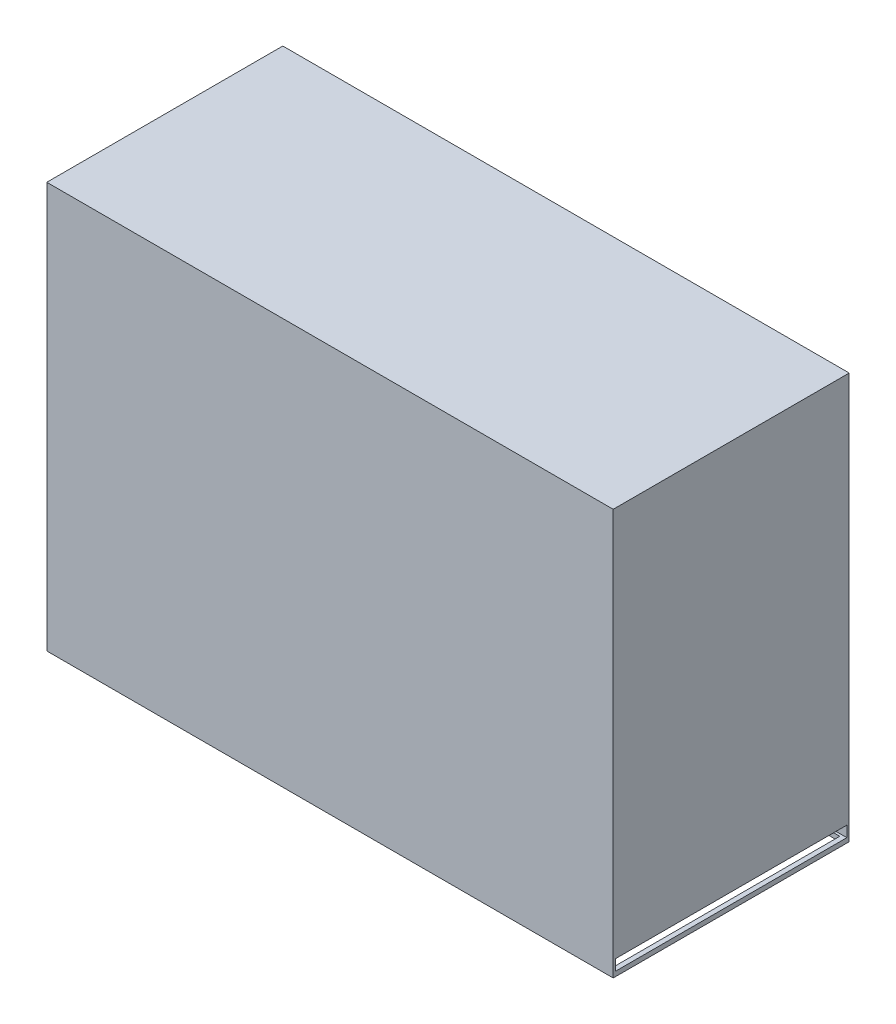
from build123d import *

# Parameters (mm, degrees)
SCHIZZO1_W                   = 120
SCHIZZO1_H                   = 82
ESTRUSIONE_ESTRUSIONE4_DEPTH = 50
SCHIZZO6_W                   = 118
SCHIZZO6_H                   = 48
TAGLIO_ESTRUSIONE2_DEPTH     = 50
SCHIZZO7_W                   = 53
SCHIZZO7_H                   = 20
ESTRUSIONE_ESTRUSIONE5_DEPTH = 27
SCHIZZO8_W                   = 52
SCHIZZO8_H                   = 19
TAGLIO_ESTRUSIONE4_DEPTH     = 27
SCHIZZO9_W                   = 5
SCHIZZO9_H                   = 1
ESTRUSIONE_ESTRUSIONE6_DEPTH = 50
SCHIZZO9_3_W                 = 113
SCHIZZO9_3_H                 = 1
ESTRUSIONE_ESTRUSIONE7_DEPTH = 1.85
SCHIZZO11_W                  = 120
SCHIZZO11_H                  = 50
SCHIZZO11_W_2                = 118
SCHIZZO11_H_2                = 48
ESTRUSIONE_ESTRUSIONE8_DEPTH = 4
SCHIZZO13_W                  = 49
SCHIZZO13_H                  = 2.3
TAGLIO_ESTRUSIONE6_DEPTH     = 119


with BuildPart() as part:
    # Schizzo1 → Estrusione-Estrusione4 (new body)
    with BuildSketch(Plane.XY):
        with Locations((60, 41)):
            Rectangle(SCHIZZO1_W, SCHIZZO1_H)
    extrude(amount=ESTRUSIONE_ESTRUSIONE4_DEPTH)

    # Schizzo6 → Taglio-Estrusione2 (cut)
    with BuildSketch(Plane.XZ):
        with Locations((60, 25)):
            Rectangle(SCHIZZO6_W, SCHIZZO6_H)
    extrude(amount=-TAGLIO_ESTRUSIONE2_DEPTH, mode=Mode.SUBTRACT)

    # Schizzo7 → Estrusione-Estrusione5 (add)
    with BuildSketch(Plane.XZ.offset(-50)):
        with Locations((27.5, 39)):
            Rectangle(SCHIZZO7_W, SCHIZZO7_H)
    extrude(amount=ESTRUSIONE_ESTRUSIONE5_DEPTH)

    # Schizzo8 → Taglio-Estrusione4 (cut)
    with BuildSketch(Plane.XZ.offset(-23)):
        with Locations((27, 39.5)):
            Rectangle(SCHIZZO8_W, SCHIZZO8_H)
    extrude(amount=-TAGLIO_ESTRUSIONE4_DEPTH, mode=Mode.SUBTRACT)

    # Schizzo9 → Estrusione-Estrusione6 (add)
    with BuildSketch(Plane(origin=(0, 50, 0), x_dir=(-1, 0, 0), z_dir=(0, -1, 0))):
        with Locations((-116.5, -4.5)):
            Rectangle(SCHIZZO9_W, SCHIZZO9_H)
    extrude(amount=ESTRUSIONE_ESTRUSIONE6_DEPTH)

    # Schizzo9<3> → Estrusione-Estrusione7 (add)
    with BuildSketch(Plane(origin=(0, 50, 0), x_dir=(-1, 0, 0), z_dir=(0, -1, 0))):
        with Locations((-57.5, -4.5)):
            Rectangle(SCHIZZO9_3_W, SCHIZZO9_3_H)
    extrude(amount=ESTRUSIONE_ESTRUSIONE7_DEPTH)

    # Schizzo11 → Estrusione-Estrusione8 (add)
    with BuildSketch(Plane.XZ):
        with Locations((60, 25)):
            Rectangle(SCHIZZO11_W, SCHIZZO11_H)
        with Locations((60, 25)):
            Rectangle(SCHIZZO11_W_2, SCHIZZO11_H_2, mode=Mode.SUBTRACT)
    extrude(amount=ESTRUSIONE_ESTRUSIONE8_DEPTH)

    # Schizzo13 → Taglio-Estrusione6 (cut)
    with BuildSketch(Plane(origin=(120, 0, 0), x_dir=(0, 0, -1), z_dir=(1, 0, 0))):
        with Locations((-25, -1.85)):
            Rectangle(SCHIZZO13_W, SCHIZZO13_H)
    extrude(amount=-TAGLIO_ESTRUSIONE6_DEPTH, mode=Mode.SUBTRACT)


solid = part.part
